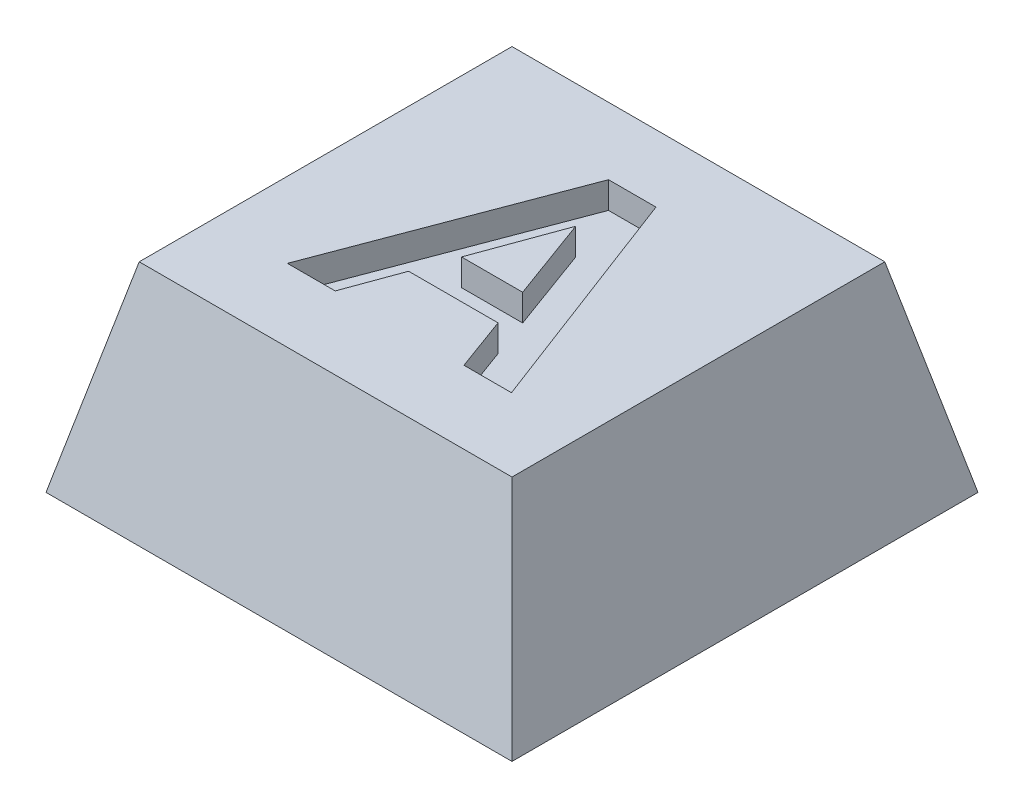
from build123d import *

# Parameters (mm, degrees)
SKETCH1_W           = 7
SKETCH1_H           = 7
BOSS_EXTRUDE1_DEPTH = 3
CUT_EXTRUDE1_DEPTH  = 7
CUT_EXTRUDE2_DEPTH  = 11
SKETCH4_R           = 1.8
CUT_EXTRUDE3_DEPTH  = 0.8
CUT_EXTRUDE4_DEPTH  = 0.4


with BuildPart() as part:
    # Sketch1 → Boss-Extrude1 (new body)
    with BuildSketch(Plane(origin=(0, 0, 0), x_dir=(1, 0, 0), z_dir=(0, 1, 0))):
        with Locations((3.5, 3.5)):
            Rectangle(SKETCH1_W, SKETCH1_H)
    extrude(amount=BOSS_EXTRUDE1_DEPTH)

    # Sketch2 → Cut-Extrude1 (cut)
    with BuildSketch(Plane.XY):
        Polygon((0, 0), (0.7, 3), (0, 3), align=None)
        Polygon((7, 0), (6.3, 3), (7, 3), align=None)
    extrude(amount=-CUT_EXTRUDE1_DEPTH, mode=Mode.SUBTRACT)

    # Sketch3 → Cut-Extrude2 (cut)
    with BuildSketch(Plane(origin=(0, 0, 0), x_dir=(0, 0, -1), z_dir=(1, 0, 0))):
        Polygon((0, 0), (0.7, 3), (0, 3), align=None)
        Polygon((7, 3), (6.3, 3), (7, 0), align=None)
    extrude(amount=CUT_EXTRUDE2_DEPTH, mode=Mode.SUBTRACT)

    # Sketch4 → Cut-Extrude3 (cut)
    with BuildSketch(Plane.XZ):
        with Locations(Location((3.5, -3.5, 0), (0, 0, 270))):
            Circle(SKETCH4_R)
    extrude(amount=-CUT_EXTRUDE3_DEPTH, mode=Mode.SUBTRACT)

    # Sketch5 → Cut-Extrude4 (cut)
    with BuildSketch(Plane(origin=(0, 3, 0), x_dir=(1, 0, 0), z_dir=(0, 1, 0))):
        Polygon((5.198883611, 1.79301719), (4.485141624, 1.79301719), (4.189969348, 2.600709497), (2.846619989, 2.600709497), (2.551447713, 1.79301719), (1.833498995, 1.79301719), (3.156515822, 5.29301719), (3.869556688, 5.29301719), align=None)
        Polygon((3.976127201, 3.184042831), (3.516191303, 4.440453087), (3.057657649, 3.184042831), align=None, mode=Mode.SUBTRACT)
    extrude(amount=-CUT_EXTRUDE4_DEPTH, mode=Mode.SUBTRACT)


solid = part.part
